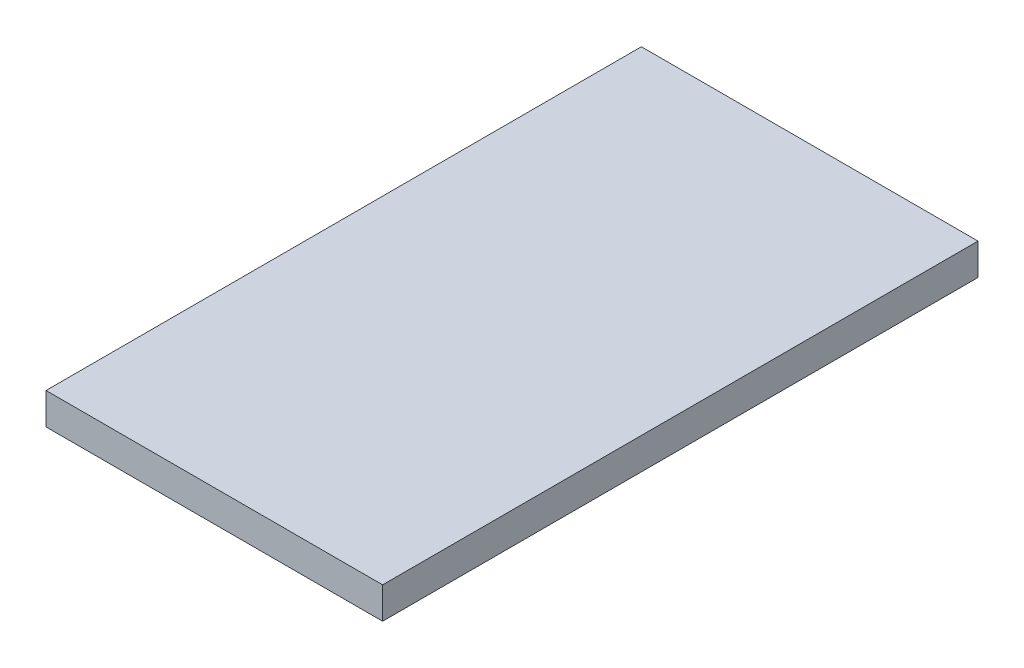
from build123d import *

# Parameters (mm, degrees)
SKETCH1_W           = 203.2
SKETCH1_H           = 359.41
BOSS_EXTRUDE1_DEPTH = 19.05


with BuildPart() as part:
    # Sketch1 → Boss-Extrude1 (new body)
    with BuildSketch(Plane(origin=(0, 0, 0), x_dir=(1, 0, 0), z_dir=(0, 1, 0))):
        with Locations((28.411397209, 47.438283817)):
            Rectangle(SKETCH1_W, SKETCH1_H)
    extrude(amount=BOSS_EXTRUDE1_DEPTH)


solid = part.part
